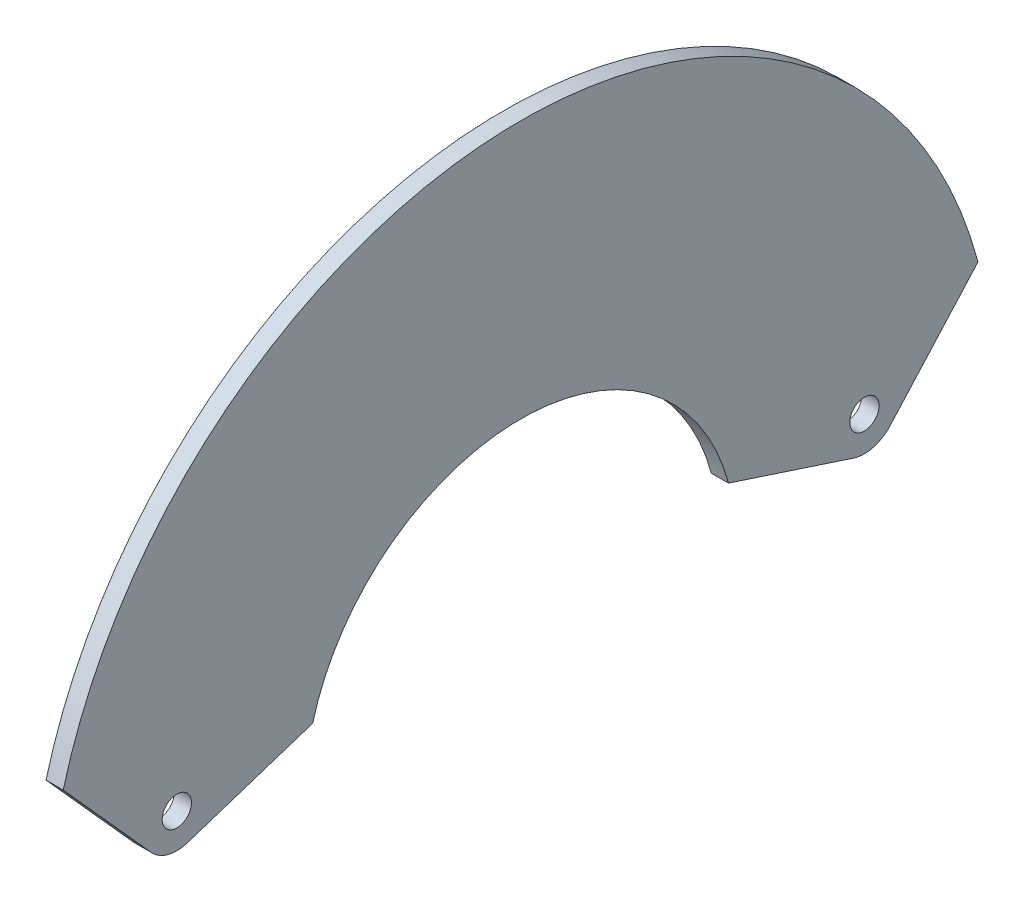
from build123d import *

# Parameters (mm, degrees)
SKETCH1_R           = 1.7
BOSS_EXTRUDE1_DEPTH = 2


with BuildPart() as part:
    # Sketch1 → Boss-Extrude1 (new body)
    with BuildSketch(Plane(origin=(0, 0, 0), x_dir=(0, 0, -1), z_dir=(1, 0, 0))):
        with BuildLine():
            Line((42.907861709, 62.851231089), (53.125920446, 74.235047481))
            ThreePointArc((53.125920446, 74.235047481), (0, 115), (-53.125920446, 74.235047481))
            Line((-53.125920446, 74.235047481), (-42.907861709, 62.851231089))
            ThreePointArc((-42.907861709, 62.851231089), (-40.966404457, 61.659429367), (-38.689152297, 61.720831308))
            Line((-38.689152297, 61.720831308), (-24.148145657, 66.470476128))
            ThreePointArc((-24.148145657, 66.470476128), (0, 85), (24.148145657, 66.470476128))
            Line((24.148145657, 66.470476128), (38.689152297, 61.720831308))
            ThreePointArc((38.689152297, 61.720831308), (40.966404457, 61.659429367), (42.907861709, 62.851231089))
        make_face()
        with Locations((39.931128277, 65.523132673)):
            Circle(SKETCH1_R, mode=Mode.SUBTRACT)
        with Locations((-39.931128277, 65.523132673)):
            Circle(SKETCH1_R, mode=Mode.SUBTRACT)
    extrude(amount=-BOSS_EXTRUDE1_DEPTH)


solid = part.part
